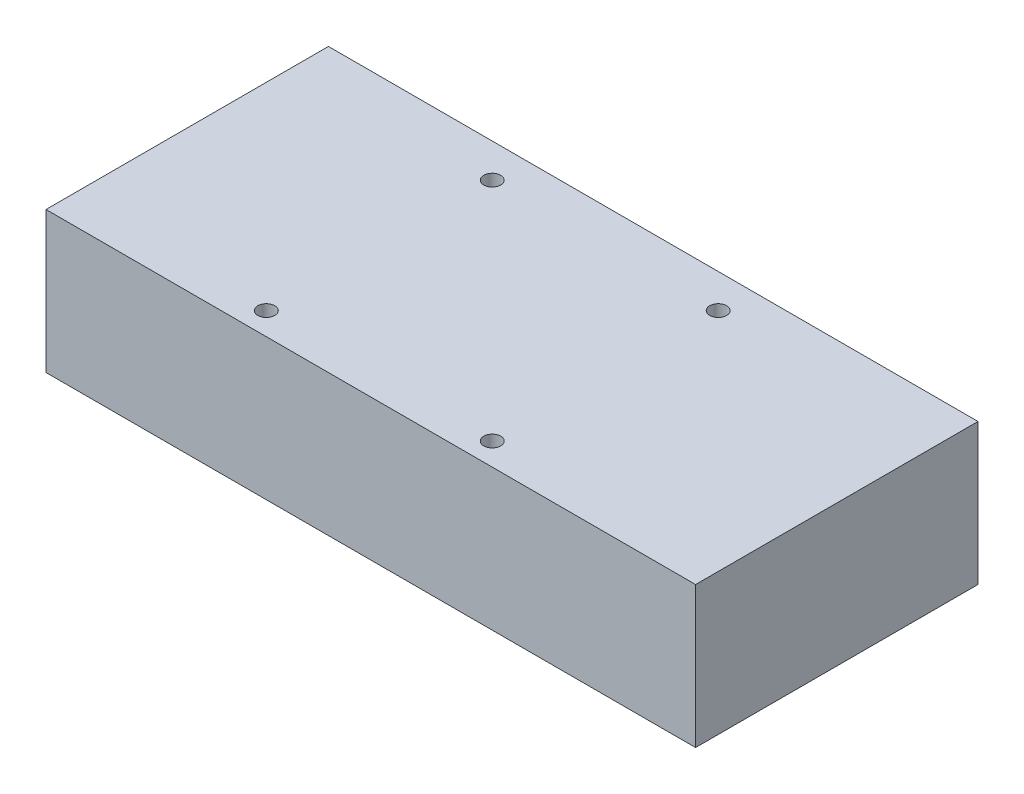
from build123d import *

# Parameters (mm, degrees)
SKETCH1_W           = 115
SKETCH1_H           = 50
SKETCH1_R           = 1.5
BOSS_EXTRUDE1_DEPTH = 25


with BuildPart() as part:
    # Sketch1 → Boss-Extrude1 (new body)
    with BuildSketch(Plane(origin=(0, 0, 0), x_dir=(1, 0, 0), z_dir=(0, 1, 0))):
        with Locations((-14.864672365, -2.065527066)):
            Rectangle(SKETCH1_W, SKETCH1_H)
        with Locations(Location((-37.364672365, 16.934472934, 0), (0, 0, 270))):
            Circle(SKETCH1_R, mode=Mode.SUBTRACT)
        with Locations(Location((2.635327635, 16.934472934, 0), (0, 0, 270))):
            Circle(SKETCH1_R, mode=Mode.SUBTRACT)
        with Locations(Location((2.635327635, -23.065527066, 0), (0, 0, 270))):
            Circle(SKETCH1_R, mode=Mode.SUBTRACT)
        with Locations(Location((-37.364672365, -23.065527066, 0), (0, 0, 270))):
            Circle(SKETCH1_R, mode=Mode.SUBTRACT)
    extrude(amount=BOSS_EXTRUDE1_DEPTH)


solid = part.part
